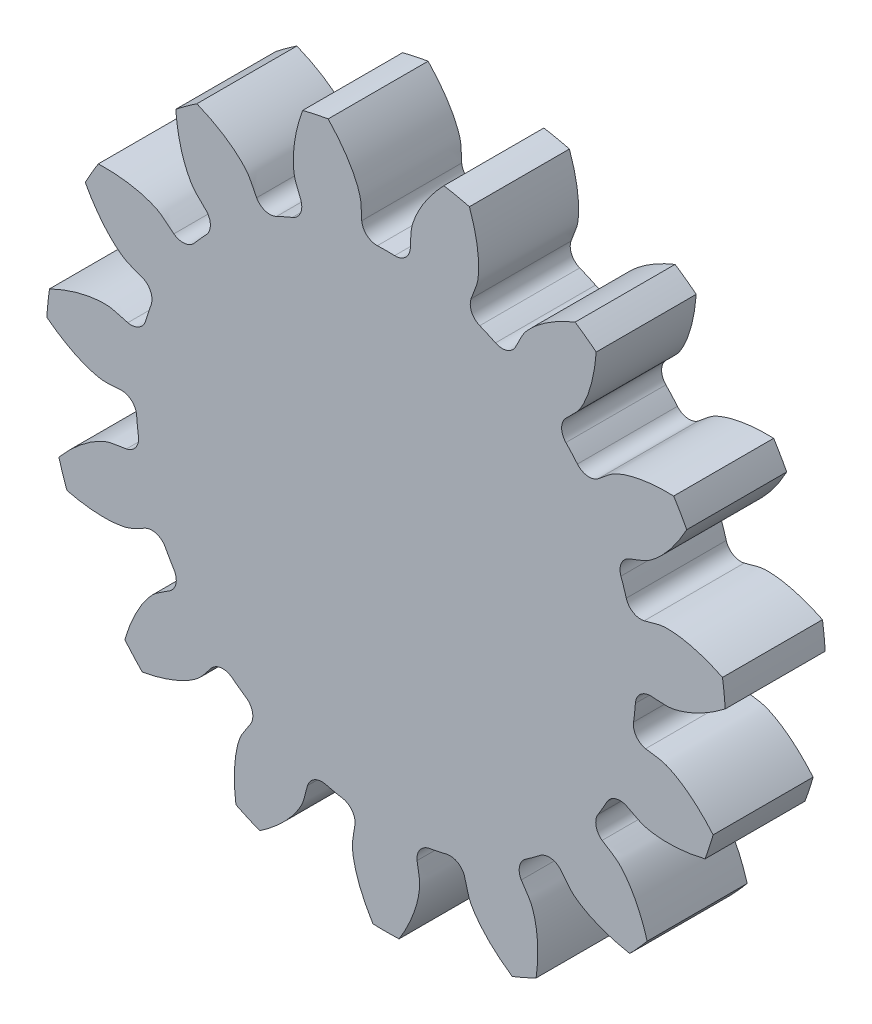
from build123d import *

# Parameters (mm, degrees)
SKETCH_1_R          = 17
LASHENA_DEPTH       = 5
CUT_EXTRUDEA_DEPTH  = 30
WWW_KYTOOL_CN_COUNT = 15


with BuildPart() as part:
    # 草图1 → LaShenA (new body)
    with BuildSketch(Plane.XY):
        Circle(SKETCH_1_R)
    extrude(amount=LASHENA_DEPTH)

    # SketchA → Cut-ExtrudeA (cut)
    with BuildSketch(Plane.XY.offset(5)):
        with BuildLine():
            ThreePointArc((0.431679835, 12.492543877), (0, 12.5), (-0.431679835, 12.492543877))
            ThreePointArc((-0.431679835, 12.492543877), (-0.959811115, 12.681379322), (-1.214597919, 13.181044369))
            add(Edge.make_bspline(
                [(-1.214597919, 13.181044369), (-1.24150294, 13.467594271), (-1.22191555, 13.80738998), (-1.28828591, 14.162987605), (-1.31410956, 14.26116029), (-1.33671458, 14.338761146), (-1.365515531, 14.427463795), (-1.401088748, 14.526992747), (-1.444131524, 14.637002398), (-1.495283248, 14.757130321), (-1.555181798, 14.886980719), (-1.624444108, 15.026130456), (-1.703670731, 15.174128011), (-1.793442972, 15.330494688), (-1.894322332, 15.494725183), (-2.006849286, 15.666288406), (-2.131542302, 15.844628274), (-2.268896822, 16.029164562), (-2.419384294, 16.219293786), (-2.583451238, 16.414390129), (-2.761518324, 16.613806392), (-2.953979566, 16.81687498), (-3.161201236, 17.022908952), (-3.463678571, 17.30630218), (-3.704760595, 17.512443075), (-3.872481699, 17.647770105)],
                knots=[0.123007883, 0.123007883, 0.123007883, 0.123007883, 0.262739282, 0.288008514, 0.299133382, 0.312280953, 0.327451227, 0.344644203, 0.363859883, 0.385098266, 0.408359351, 0.43364314, 0.460949632, 0.490278827, 0.521630724, 0.555005325, 0.590402629, 0.627822636, 0.667265346, 0.708730759, 0.752218875, 0.797729694, 0.845263216, 0.894819441, 1, 1, 1, 1], degree=3))
            ThreePointArc((-3.872481699, 17.647770105), (0, 18.067647998), (3.872481699, 17.647770105))
            add(Edge.make_bspline(
                [(1.214597919, 13.181044369), (1.24150294, 13.467594271), (1.22191555, 13.80738998), (1.28828591, 14.162987605), (1.31410956, 14.26116029), (1.33671458, 14.338761146), (1.365515531, 14.427463795), (1.401088748, 14.526992747), (1.444131524, 14.637002398), (1.495283248, 14.757130321), (1.555181798, 14.886980719), (1.624444108, 15.026130456), (1.703670731, 15.174128011), (1.793442972, 15.330494688), (1.894322332, 15.494725183), (2.006849286, 15.666288406), (2.131542302, 15.844628274), (2.268896822, 16.029164562), (2.419384294, 16.219293786), (2.583451238, 16.414390129), (2.761518324, 16.613806392), (2.953979566, 16.81687498), (3.161201236, 17.022908952), (3.463678571, 17.30630218), (3.704760595, 17.512443075), (3.872481699, 17.647770105)],
                knots=[0.123007883, 0.123007883, 0.123007883, 0.123007883, 0.262739282, 0.288008514, 0.299133382, 0.312280953, 0.327451227, 0.344644203, 0.363859883, 0.385098266, 0.408359351, 0.43364314, 0.460949632, 0.490278827, 0.521630724, 0.555005325, 0.590402629, 0.627822636, 0.667265346, 0.708730759, 0.752218875, 0.797729694, 0.845263216, 0.894819441, 1, 1, 1, 1], degree=3))
            ThreePointArc((1.214597919, 13.181044369), (0.959811115, 12.681379322), (0.431679835, 12.492543877))
        make_face()
    cut_extrudea = extrude(amount=-CUT_EXTRUDEA_DEPTH, mode=Mode.SUBTRACT)

    # www.KYTool.cn: Cut-ExtrudeA ×15 about axis
    www_kytool_cn_axis = Axis((0, 0, -88.99), (0, 0, 1))
    for i in range(1, WWW_KYTOOL_CN_COUNT):
        add(cut_extrudea.rotate(www_kytool_cn_axis, i * 360 / WWW_KYTOOL_CN_COUNT), mode=Mode.SUBTRACT)


solid = part.part
